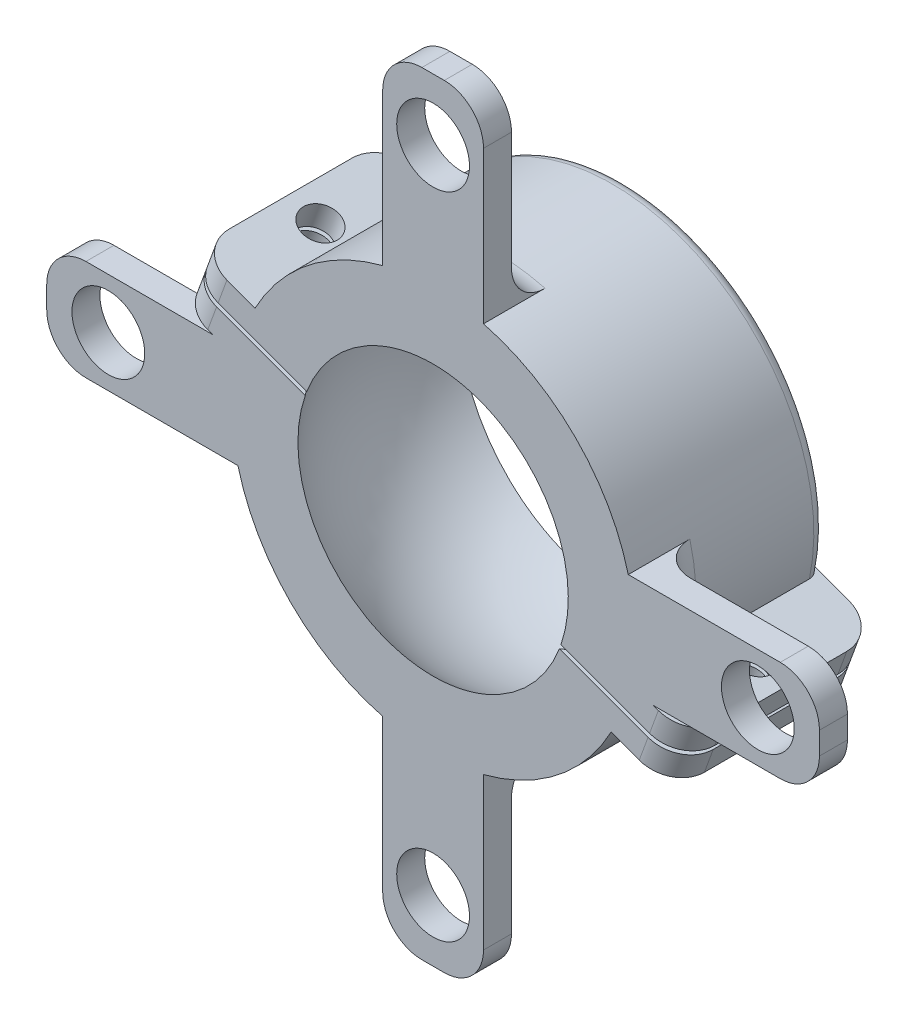
from build123d import *
from build123d.topology import SkipClean

# Parameters (mm, degrees)
EXTRUDE_1_DEPTH      = 12.5
EXTRUDE_1_DEPTH_BACK = 6.5
SKETCH_1_R           = 18
EXTRUDE_2_DEPTH      = 17.5
EXTRUDE_2_DEPTH_BACK = 1
SKETCH_5_W           = 2
SKETCH_5_H           = 9
EXTRUDE_3_DEPTH      = 17.5
EXTRUDE_3_DEPTH_BACK = 1
SKETCH_6_W           = 2
SKETCH_6_H           = 9
EXTRUDE_4_DEPTH      = 17.5
EXTRUDE_4_DEPTH_BACK = 1
SKETCH_8_W           = 9
SKETCH_8_H           = 2
EXTRUDE_5_DEPTH      = 17.5
EXTRUDE_5_DEPTH_BACK = 1
SKETCH_9_W           = 9
SKETCH_9_H           = 2
SKETCH_14_W          = 19
SKETCH_14_H          = 5
EXTRUDE_6_DEPTH      = 6.5
SKETCH_15_W          = 19
SKETCH_15_H          = 5
EXTRUDE_7_DEPTH      = 6.5
SKETCH_17_W          = 19
SKETCH_17_H          = 0.4
CUT_EXTRUDE_1_DEPTH  = 50
SKETCH_34_R          = 3.05
CUT_EXTRUDE_3_DEPTH  = 2
SKETCH_35_R          = 3.05
SKETCH_35_W          = 17.5
SKETCH_35_H          = 9
SKETCH_35_W_2        = 9
SKETCH_35_H_2        = 17.5
EXTRUDE_8_DEPTH      = 2.5
SKETCH_36_R          = 35
CUT_EXTRUDE_4_DEPTH  = 2
SKETCH_37_R          = 1.6
CUT_EXTRUDE_5_DEPTH  = 8
SKETCH_39_R          = 1.6
CUT_EXTRUDE_6_DEPTH  = 8
FILLET_1_R           = 3
FILLET_2_R           = 3.5
FILLET_3_R           = 3.5
SKETCH_40_R          = 3.25
CUT_EXTRUDE_7_DEPTH  = 8
FILLET_4_R           = 3
FILLET_5_R           = 3
FILLET_6_R           = 3
FILLET_7_R           = 1
FILLET_8_R           = 1


with BuildPart() as part:
    # 草图1 → 凸台-拉伸1 (new, two sides: drawn at the far end of the back side and taken through both)
    with BuildSketch(Plane.XY.offset(-EXTRUDE_1_DEPTH_BACK)):
        Circle(SKETCH_1_R)
    extrude(amount=EXTRUDE_1_DEPTH + EXTRUDE_1_DEPTH_BACK)

    # 草图2 → 切除-旋转1 (revolve, cut)
    with BuildSketch(Plane.XY):
        with BuildLine():
            Line((0, 16), (0, -16))
            ThreePointArc((0, -16), (16, 0), (0, 16))
        make_face()
    revolve(axis=Axis((0, 16, 0), (0, -1, 0)), mode=Mode.SUBTRACT)

    # 草图5 → 凸台-拉伸2 (add, two sides: drawn at the far end of the back side and taken through both)
    with BuildSketch(Plane(origin=(17, 0, 0), x_dir=(0, 0, -1), z_dir=(1, 0, 0)).offset(-EXTRUDE_2_DEPTH_BACK)):
        with Locations((-11.5, 0)):
            Rectangle(SKETCH_5_W, SKETCH_5_H)
    extrude(amount=EXTRUDE_2_DEPTH + EXTRUDE_2_DEPTH_BACK)

    # 草图6 → 凸台-拉伸3 (add, two sides: drawn at the far end of the back side and taken through both)
    with BuildSketch(Plane.ZY.offset(17).offset(-EXTRUDE_3_DEPTH_BACK)):
        with Locations((11.5, 0)):
            Rectangle(SKETCH_6_W, SKETCH_6_H)
    extrude(amount=EXTRUDE_3_DEPTH + EXTRUDE_3_DEPTH_BACK)

    # 草图8 → 凸台-拉伸4 (add, two sides: drawn at the far end of the back side and taken through both)
    with BuildSketch(Plane(origin=(0, 17, 0), x_dir=(1, 0, 0), z_dir=(0, 1, 0)).offset(-EXTRUDE_4_DEPTH_BACK)):
        with Locations((0, -11.5)):
            Rectangle(SKETCH_8_W, SKETCH_8_H)
    extrude(amount=EXTRUDE_4_DEPTH + EXTRUDE_4_DEPTH_BACK)

    # 草图9 → 凸台-拉伸5 (add, two sides: drawn at the far end of the back side and taken through both)
    with BuildSketch(Plane(origin=(0, -17, 0), x_dir=(-1, 0, 0), z_dir=(0, -1, 0)).offset(-EXTRUDE_5_DEPTH_BACK)):
        with Locations((0, -11.5)):
            Rectangle(SKETCH_9_W, SKETCH_9_H)
    extrude(amount=EXTRUDE_5_DEPTH + EXTRUDE_5_DEPTH_BACK)

    # 草图14 → 凸台-拉伸6 (add)
    with BuildSketch(Plane(origin=(-15.974774553, 5.814342437, 0), x_dir=(0, 0, 1), z_dir=(-0.9396926207859094, 0.34202014332566616, 0))):
        with Locations((3, 0)):
            Rectangle(SKETCH_14_W, SKETCH_14_H)
    extrude(amount=EXTRUDE_6_DEPTH)

    # 草图15 → 凸台-拉伸7 (add)
    with BuildSketch(Plane(origin=(15.974774553, -5.814342437, 0), x_dir=(0, 0, -1), z_dir=(0.9396926207859094, -0.342020143325666, -6.982962677686269e-15))):
        with Locations((-3, 0)):
            Rectangle(SKETCH_15_W, SKETCH_15_H)
    extrude(amount=EXTRUDE_7_DEPTH)

    # 草图17 → 切除-拉伸1 (cut)
    with BuildSketch(Plane(origin=(22.082776588, -8.037473368, 0), x_dir=(0, 0, -1), z_dir=(0.9396926207859094, -0.34202014332566605, -6.9969521276040904e-15))):
        with Locations((-3, 0)):
            Rectangle(SKETCH_17_W, SKETCH_17_H)
    extrude(amount=-CUT_EXTRUDE_1_DEPTH, mode=Mode.SUBTRACT)


with BuildPart() as cut_extrude_1_piece_1:
    # of the separate pieces the step leaves, piece 1, a body of its own (cut_extrude_1_pieces)
    add(part.part.solids().sort_by_distance((-15.895481302, 8.445926484, -6.5))[0])


with BuildPart() as cut_extrude_1_piece_2:
    # of the separate pieces the step leaves, piece 2, a body of its own (cut_extrude_1_pieces)
    add(part.part.solids().sort_by_distance((4.5, -34.5, 12.5))[0])


with BuildPart() as cut_extrude_3_tool:
    # 草图34 → 切除-拉伸3 (new body)
    with BuildSketch(Plane.XY.offset(12.5)):
        with Locations((29, 0)):
            Circle(SKETCH_34_R)
        with Locations((0, -29)):
            Circle(SKETCH_34_R)
        with Locations((0, 29)):
            Circle(SKETCH_34_R)
        with Locations((-29, 0)):
            Circle(SKETCH_34_R)
    extrude(amount=-CUT_EXTRUDE_3_DEPTH)


with BuildPart() as cut_extrude_1_piece_1_1:
    add(cut_extrude_1_piece_1.part)

    # 切除-拉伸3: cut by cut_extrude_3_tool
    add(cut_extrude_3_tool.part, mode=Mode.SUBTRACT)



with BuildPart() as cut_extrude_1_piece_2_1:
    add(cut_extrude_1_piece_2.part)

    # 切除-拉伸3: cut by cut_extrude_3_tool
    add(cut_extrude_3_tool.part, mode=Mode.SUBTRACT)


with BuildPart() as cut_extrude_1_piece_1_2:
    with SkipClean():  # the faces are left unmerged after this step: merging them gives an invalid solid
        add(cut_extrude_1_piece_1_1.part)

        add(cut_extrude_1_piece_2_1.part)  # 凸台-拉伸8 merges 切除-拉伸1 piece 2
        # 草图35 → 凸台-拉伸8 (add)
        # profile 1 of 4: a face of its own
        with BuildSketch(Plane(origin=(0, 0, 10.5), x_dir=(-1, 0, 0), z_dir=(0, 0, -1))):
            with BuildLine():
                Line((-4.5, -17.428425058), (-4.5, -34.5))
                Line((-4.5, -34.5), (4.5, -34.5))
                Line((4.5, -34.5), (4.5, -17.428425058))
                ThreePointArc((4.5, -17.428425058), (0, -18), (-4.5, -17.428425058))
            make_face()
            with Locations((0, -29)):
                Circle(SKETCH_35_R, mode=Mode.SUBTRACT)
        # profile 2 of 4: a face of its own
        with BuildSketch(Plane(origin=(0, 0, 10.5), x_dir=(-1, 0, 0), z_dir=(0, 0, -1))):
            with Locations((25.75, 0)):
                Rectangle(SKETCH_35_W, SKETCH_35_H)
            with Locations((29, 0)):
                Circle(SKETCH_35_R, mode=Mode.SUBTRACT)
        # profile 3 of 4: a face of its own
        with BuildSketch(Plane(origin=(0, 0, 10.5), x_dir=(-1, 0, 0), z_dir=(0, 0, -1))):
            with Locations((0, 25.75)):
                Rectangle(SKETCH_35_W_2, SKETCH_35_H_2)
            with Locations((0, 29)):
                Circle(SKETCH_35_R, mode=Mode.SUBTRACT)
        # profile 4 of 4: a face of its own
        with BuildSketch(Plane(origin=(0, 0, 10.5), x_dir=(-1, 0, 0), z_dir=(0, 0, -1))):
            with Locations((-25.75, 0)):
                Rectangle(SKETCH_35_W, SKETCH_35_H)
            with Locations((-29, 0)):
                Circle(SKETCH_35_R, mode=Mode.SUBTRACT)
        extrude(amount=EXTRUDE_8_DEPTH)

    # 草图36 → 切除-拉伸4 (cut)
    with BuildSketch(Plane.XY.offset(12.5)):
        Circle(SKETCH_36_R)
    extrude(amount=-CUT_EXTRUDE_4_DEPTH, mode=Mode.SUBTRACT)

    # 草图37 → 切除-拉伸5 (cut)
    with BuildSketch(Plane(origin=(-0.855050358, -2.349231552, 0), x_dir=(0.9396926207859094, -0.342020143325666, 0), z_dir=(-0.342020143325666, -0.9396926207859094, 0))):
        with Locations((20.662771735, 2)):
            Circle(SKETCH_37_R)
    extrude(amount=-CUT_EXTRUDE_5_DEPTH, mode=Mode.SUBTRACT)

    # 草图39 → 切除-拉伸6 (cut)
    with BuildSketch(Plane(origin=(0.855050358, 2.349231552, 0), x_dir=(0.9396926207859094, -0.34202014332566616, 0), z_dir=(0.3420201433256661, 0.9396926207859093, 0))):
        with Locations((-20.662771735, -2)):
            Circle(SKETCH_39_R)
    extrude(amount=-CUT_EXTRUDE_6_DEPTH, mode=Mode.SUBTRACT)

    # 圆角1
    fillet_1_edges = [cut_extrude_1_piece_1_2.edges().sort_by_distance(p)[0] for p in [
        (-22.544503782, 6.76888833, 10.5),
        (-22.544503782, 6.76888833, -6.5),
        (21.621049395, -9.306058406, 10.5),
        (21.621049395, -9.306058406, -6.5),
    ]]
    fillet(fillet_1_edges, radius=FILLET_1_R)

    # 圆角2
    fillet_2_edges = [cut_extrude_1_piece_1_2.edges().sort_by_distance(p)[0] for p in [
        (-34.5, 4.5, 9.25),
        (-34.5, -4.5, 9.25),
        (-4.5, -34.5, 9.25),
        (4.5, -34.5, 9.25),
    ]]
    fillet(fillet_2_edges, radius=FILLET_2_R)

    # 圆角3
    fillet_3_edges = [cut_extrude_1_piece_1_2.edges().sort_by_distance(p)[0] for p in [
        (34.5, -4.5, 9.25),
        (34.5, 4.5, 9.25),
        (4.5, 34.5, 9.25),
        (-4.5, 34.5, 9.25),
    ]]
    fillet(fillet_3_edges, radius=FILLET_3_R)

    # 草图40 → 切除-拉伸7 (cut)
    with BuildSketch(Plane(origin=(0, 0, 8), x_dir=(-1, 0, 0), z_dir=(0, 0, -1))):
        with Locations((0, 29)):
            Circle(SKETCH_40_R)
        with Locations((29, 0)):
            Circle(SKETCH_40_R)
        with Locations((-29, 0)):
            Circle(SKETCH_40_R)
        with Locations((0, -29)):
            Circle(SKETCH_40_R)
    extrude(amount=-CUT_EXTRUDE_7_DEPTH, mode=Mode.SUBTRACT)

    # 圆角4
    fillet_4_edges = [cut_extrude_1_piece_1_2.edges().sort_by_distance(p)[0] for p in [
        (0, 18, 8),
        (17.995848855, 0.386553991, 8),
    ]]
    fillet(fillet_4_edges, radius=FILLET_4_R)

    # 圆角5
    fillet_5_edges = [cut_extrude_1_piece_1_2.edges().sort_by_distance(p)[0] for p in [
        (0, -18, 8),
        (-17.995848855, -0.386553991, 8),
    ]]
    fillet(fillet_5_edges, radius=FILLET_5_R)

    # 圆角6
    fillet_6_edges = [cut_extrude_1_piece_1_2.edges().sort_by_distance(p)[0] for p in [
        (22.544503782, -6.76888833, -6.5),
        (22.544503782, -6.76888833, 10.5),
        (-21.621049395, 9.306058406, 10.5),
        (-21.621049395, 9.306058406, -6.5),
    ]]
    fillet(fillet_6_edges, radius=FILLET_6_R)

    # 圆角7
    fillet_7_edges = [cut_extrude_1_piece_1_2.edges().sort_by_distance(p)[0] for p in [
        (6.15636258, 16.914467174, -6.5),
    ]]
    fillet(fillet_7_edges, radius=FILLET_7_R)

    # 圆角8
    fillet_8_edges = [cut_extrude_1_piece_1_2.edges().sort_by_distance(p)[0] for p in [
        (-6.15636258, -16.914467174, -6.5),
    ]]
    fillet(fillet_8_edges, radius=FILLET_8_R)


solid = cut_extrude_1_piece_1_2.part
